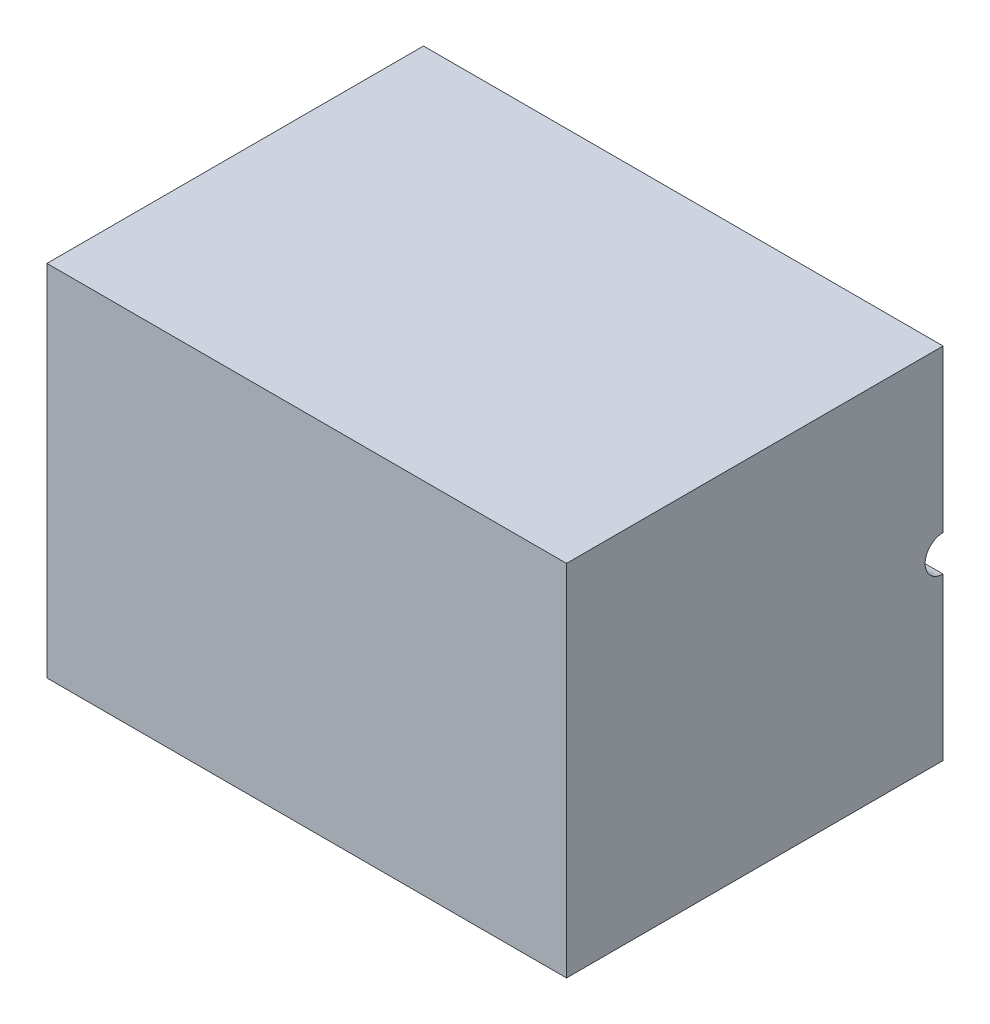
from build123d import *

# Parameters (mm, degrees)
SKETCH1_W            = 144.702517086
SKETCH1_H            = 104.868678114
BOSS_EXTRUDE5_DEPTH  = 100
CUT_SWEEP2_PROFILE_R = 5


with BuildPart() as part:
    # Sketch1 → Boss-Extrude5 (new body)
    with BuildSketch(Plane(origin=(0, 0, 0), x_dir=(1, 0, 0), z_dir=(0, 1, 0))):
        Rectangle(SKETCH1_W, SKETCH1_H)
    extrude(amount=BOSS_EXTRUDE5_DEPTH)

    # Cut-Sweep2: sweep along a path in Sketch14
    with BuildLine(Plane(origin=(0, 0, -52.434339057), x_dir=(-1, 0, 0), z_dir=(0, 0, -1))) as cut_sweep2_path:
        Line((-72.351258543, 50), (-29.003803048, 50))
        Line((-29.003803048, 50), (-15.905311349, 69.881639186))
        Line((-15.905311349, 69.881639186), (9.044196649, 69.881639186))
        Line((9.044196649, 69.881639186), (23.390163748, 50))
        Line((23.390163748, 50), (72.351258543, 50))
    # Cut-Sweep2 profile (on start of the path) → Cut-Sweep2 (sweep, cut)
    with BuildSketch(Plane(origin=(72.351258543, 50, -52.434339057), x_dir=(0, 0, -1), z_dir=(-1, 0, 0))):
        Circle(CUT_SWEEP2_PROFILE_R)
    sweep(path=cut_sweep2_path.line, transition=Transition.RIGHT, mode=Mode.SUBTRACT)


solid = part.part
